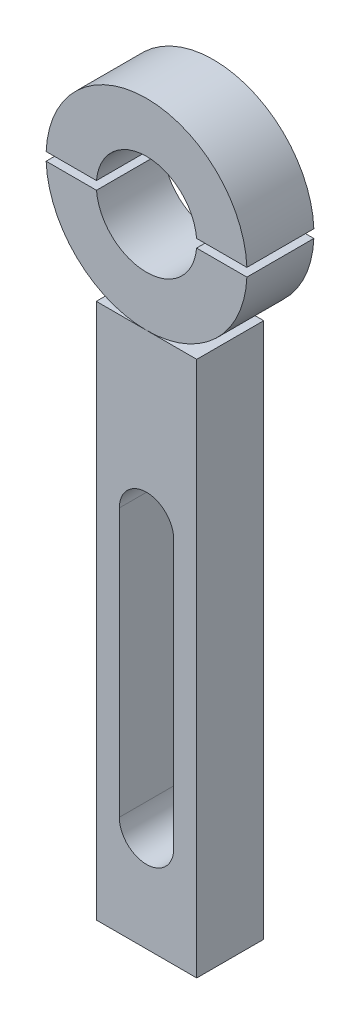
from build123d import *

# Parameters (mm, degrees)
EXTRUDE1_DEPTH     = 6.35
EXTRUDE1_2_DEPTH   = 6.35
SKETCH2_W          = 19.05
SKETCH2_H          = 101.6
EXTRUDE2_DEPTH     = 12.7
CUT_EXTRUDE1_DEPTH = 123.80059023


with BuildPart() as part:
    # Sketch1 → Extrude1 (new, symmetric)
    with BuildSketch(Plane.XY):
        with BuildLine():
            Line((-19.033456358, 0.79375), (-9.491869465, 0.79375))
            ThreePointArc((-9.491869465, 0.79375), (0, 9.525), (9.491869465, 0.79375))
            Line((9.491869465, 0.79375), (19.033456358, 0.79375))
            ThreePointArc((19.033456358, 0.79375), (0, 19.05), (-19.033456358, 0.79375))
        make_face()
    extrude(amount=EXTRUDE1_DEPTH, both=True)


with BuildPart() as body_2:
    # Sketch1 → Extrude1 2 (new, symmetric)
    with BuildSketch(Plane.XY):
        with BuildLine():
            Line((19.033456358, -0.79375), (9.491869465, -0.79375))
            ThreePointArc((9.491869465, -0.79375), (0, -9.525), (-9.491869465, -0.79375))
            Line((-9.491869465, -0.79375), (-19.033456358, -0.79375))
            ThreePointArc((-19.033456358, -0.79375), (0, -19.05), (19.033456358, -0.79375))
        make_face()
    extrude(amount=EXTRUDE1_2_DEPTH, both=True)


with BuildPart() as body_3:
    # Sketch2 → Extrude2 (new body)
    with BuildSketch(Plane.XY.offset(6.35)):
        with Locations((0, -69.85)):
            Rectangle(SKETCH2_W, SKETCH2_H)
    extrude(amount=-EXTRUDE2_DEPTH)

    # Sketch3 → Cut-Extrude1 (cut, through all)
    with BuildSketch(Plane.XY.offset(6.35)):
        with BuildLine():
            Line((-5.159375, -101.6), (-5.159375, -50.8))
            ThreePointArc((-5.159375, -50.8), (0, -45.640625), (5.159375, -50.8))
            Line((5.159375, -50.8), (5.159375, -101.6))
            ThreePointArc((5.159375, -101.6), (0, -106.759375), (-5.159375, -101.6))
        make_face()
    extrude(amount=-CUT_EXTRUDE1_DEPTH, mode=Mode.SUBTRACT)


solid = Compound([part.part, body_2.part, body_3.part])
